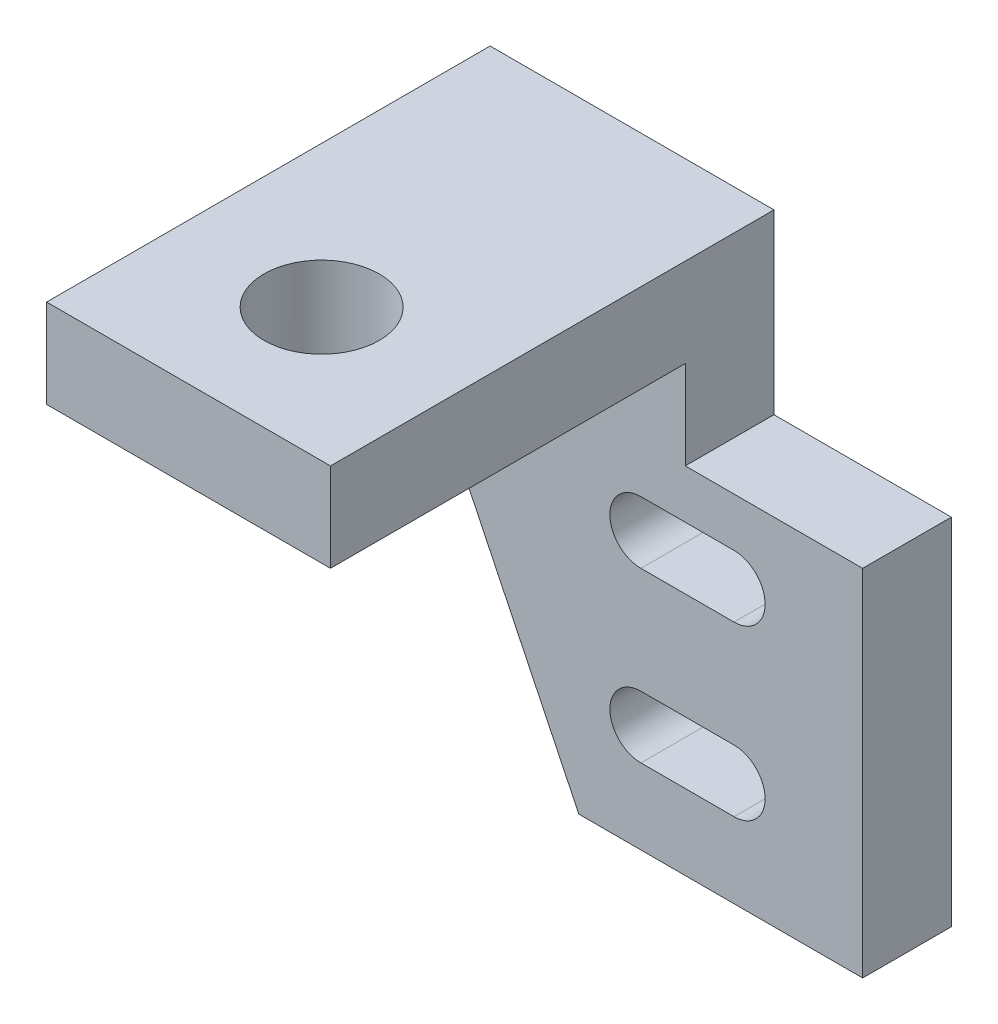
from build123d import *

# Parameters (mm, degrees)
ESTRUSIONE_ESTRUSIONE1_DEPTH = 5
SCHIZZO2_W                   = 16
SCHIZZO2_H                   = 5
ESTRUSIONE_ESTRUSIONE2_DEPTH = 20
TAGLIO_ESTRUSIONE1_REACH     = 40.807
SCHIZZO3_R                   = 3.25


with BuildPart() as part:
    # Schizzo1 → Estrusione-Estrusione1 (new body)
    with BuildSketch(Plane.XY):
        Polygon((-16, 0), (0, 0), (0, -10), (10, -10), (10, -30), (-6, -30), (-16, -9.295201316), align=None)
        with BuildLine():
            Line((2.75, -22.25), (-2.5, -22.25))
            ThreePointArc((-2.5, -22.25), (-4.25, -24), (-2.5, -25.75))
            Line((-2.5, -25.75), (2.75, -25.75))
            ThreePointArc((2.75, -25.75), (4.5, -24), (2.75, -22.25))
        make_face(mode=Mode.SUBTRACT)
        with BuildLine():
            Line((2.75, -12.75), (-2.5, -12.75))
            ThreePointArc((-2.5, -12.75), (-4.25, -14.5), (-2.5, -16.25))
            Line((-2.5, -16.25), (2.75, -16.25))
            ThreePointArc((2.75, -16.25), (4.5, -14.5), (2.75, -12.75))
        make_face(mode=Mode.SUBTRACT)
    extrude(amount=ESTRUSIONE_ESTRUSIONE1_DEPTH)

    # Schizzo2 → Estrusione-Estrusione2 (add)
    with BuildSketch(Plane.XY.offset(5)):
        with Locations((-8, -2.5)):
            Rectangle(SCHIZZO2_W, SCHIZZO2_H)
    extrude(amount=ESTRUSIONE_ESTRUSIONE2_DEPTH)

    # Schizzo3 → Taglio-Estrusione1 (cut, up to next)
    with BuildSketch(Plane.XZ.offset(5), mode=Mode.PRIVATE) as taglio_estrusione1_sk1:
        with Locations((-8, 17.5)):
            Circle(SCHIZZO3_R)
    taglio_estrusione1_tool1 = extrude(taglio_estrusione1_sk1.sketch, amount=-TAGLIO_ESTRUSIONE1_REACH, mode=Mode.PRIVATE) & part.part
    add(taglio_estrusione1_tool1.solids().sort_by_distance((-8, -5, 17.5))[0], mode=Mode.SUBTRACT)


solid = part.part
